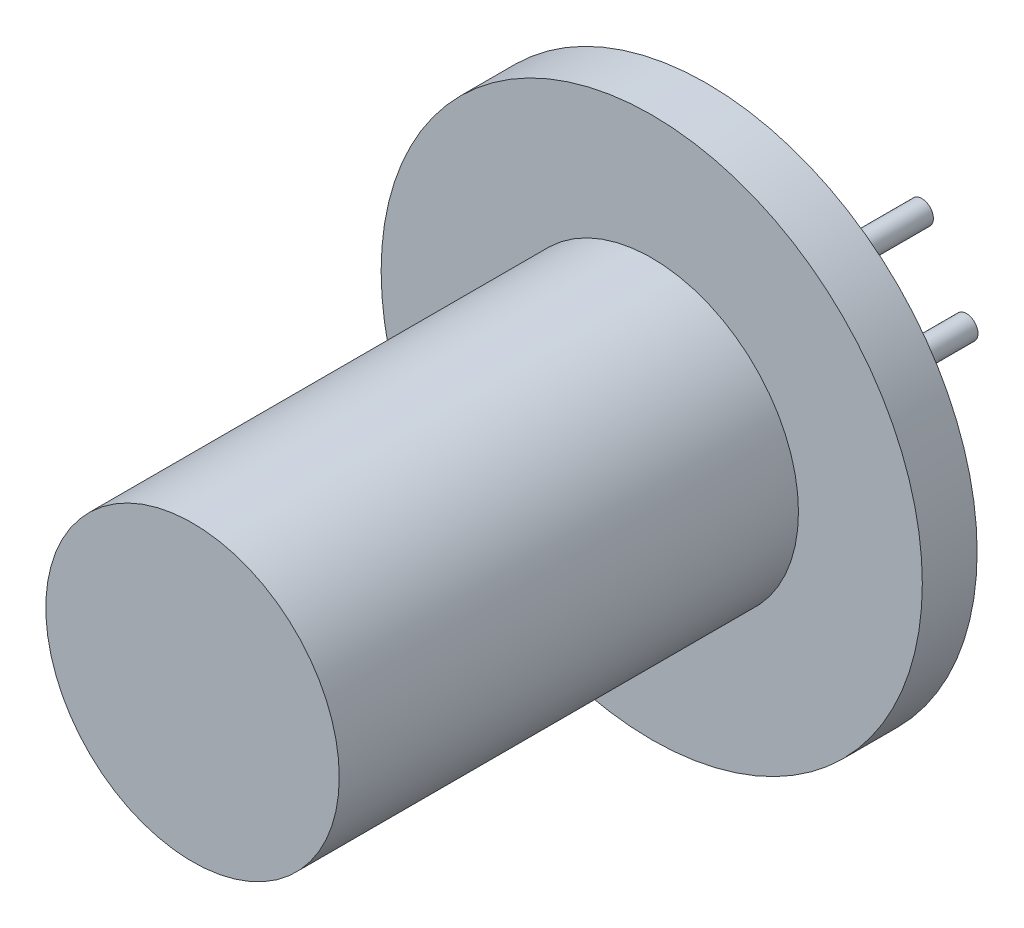
from build123d import *

# Parameters (mm, degrees)
SKETCH4_R           = 0.340929453
BOSS_EXTRUDE1_DEPTH = 4.7625


with BuildPart() as part:
    # Sketch3 → Revolve1 (revolve)
    with BuildSketch(Plane(origin=(0, 0, 0), x_dir=(1, 0, 0), z_dir=(0, 1, 0))):
        Polygon((0, 0), (0, 3.18516), (3.1623, 3.18516), (3.1623, 3.8354), (4.2799, 3.8354), (4.2799, 1.6129), (7.9629, 1.6129), (7.9629, 0), (4.318, 0), (4.318, -13.5128), (0, -13.5128), align=None)
    revolve(axis=Axis((0, 0, 13.5128), (0, 0, -1)))

    # Sketch4 → Boss-Extrude1 (add)
    with BuildSketch(Plane(origin=(0, 0, -3.18516), x_dir=(-1, 0, 0), z_dir=(0, 0, -1))):
        with Locations((0, 1.516184255)):
            Circle(SKETCH4_R)
        with Locations((1.313054082, -0.758092128)):
            Circle(SKETCH4_R)
        with Locations((-1.313054082, -0.758092128)):
            Circle(SKETCH4_R)
    extrude(amount=BOSS_EXTRUDE1_DEPTH)


solid = part.part
